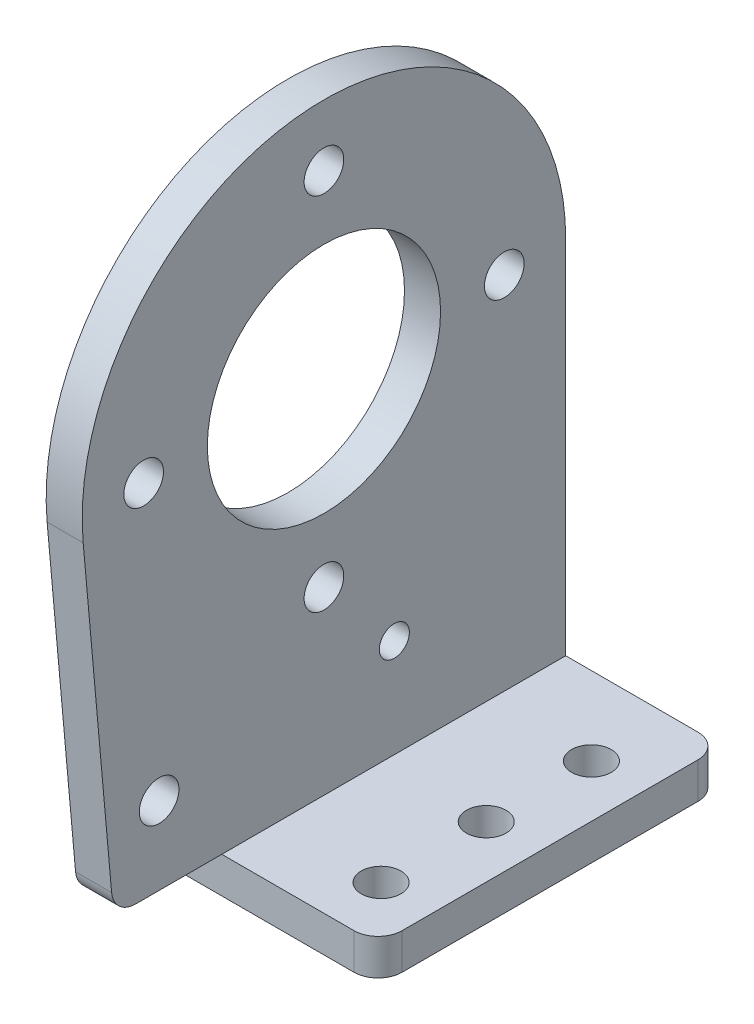
from build123d import *

# Parameters (mm, degrees)
SKETCH_2_W          = 28.61033589
SKETCH_2_H          = 3
EXTRUDE_5_DEPTH     = 16
SKETCH_3_R          = 1.65
CUT_EXTRUDE_1_DEPTH = 10
SKETCH_4_R          = 1.65
SKETCH_4_R_2        = 1.25
SKETCH_4_R_3        = 9.7
EXTRUDE_8_DEPTH     = 3
FILLET_1_R          = 2


with BuildPart() as part:
    # 草图2 → 凸台-拉伸5 (new body)
    with BuildSketch(Plane.ZY):
        with Locations((-23.305167945, 11.5)):
            Rectangle(SKETCH_2_W, SKETCH_2_H)
    extrude(amount=-EXTRUDE_5_DEPTH)

    # 草图3 → 切除-拉伸1 (cut)
    with BuildSketch(Plane(origin=(0, 13, 0), x_dir=(1, 0, 0), z_dir=(0, 1, 0))):
        with Locations(Location((11.65, 31.1, 0), (0, 0, 270))):
            Circle(SKETCH_3_R)
        with Locations(Location((11.65, 22.35, 0), (0, 0, 90))):
            Circle(SKETCH_3_R)
        with Locations(Location((11.65, 13.6, 0), (0, 0, 270))):
            Circle(SKETCH_3_R)
    extrude(amount=-CUT_EXTRUDE_1_DEPTH, mode=Mode.SUBTRACT)

    # 草图4 → 凸台-拉伸8 (add)
    with BuildSketch(Plane(origin=(0, 0, 0), x_dir=(0, 0, -1), z_dir=(1, 0, 0))):
        with BuildLine():
            Line((0, 13), (37.61033589, 13))
            Line((37.61033589, 13), (37.61033589, 42.99965258))
            ThreePointArc((37.61033589, 42.99965258), (16.600372012, 63.090063758), (-2.530280254, 41.20259366))
            Line((-2.530280254, 41.20259366), (0, 13))
        make_face()
        with Locations(Location((17.49980147, 57.99965258, 0), (0, 0, 180))):
            Circle(SKETCH_4_R, mode=Mode.SUBTRACT)
        with Locations(Location((32.49980147, 42.99965258, 0), (0, 0, 180))):
            Circle(SKETCH_4_R, mode=Mode.SUBTRACT)
        with Locations(Location((17.49980147, 27.99965258, 0), (0, 0, 180))):
            Circle(SKETCH_4_R, mode=Mode.SUBTRACT)
        with Locations(Location((2.49980147, 42.99965258, 0), (0, 0, 180))):
            Circle(SKETCH_4_R, mode=Mode.SUBTRACT)
        with Locations(Location((23.354935737, 21.197394906, 0), (0, 0, 180))):
            Circle(SKETCH_4_R_2, mode=Mode.SUBTRACT)
        with Locations(Location((3.788610616, 19.472011044, 0), (0, 0, 180))):
            Circle(SKETCH_4_R, mode=Mode.SUBTRACT)
        with Locations(Location((17.49980147, 42.99965258, 0), (0, 0, 180))):
            Circle(SKETCH_4_R_3, mode=Mode.SUBTRACT)
    extrude(amount=EXTRUDE_8_DEPTH)

    # 圆角1
    fillet_1_edges = [part.edges().sort_by_distance(p)[0] for p in [
        (16, 11.5, -37.61033589),
        (1.5, 13, 0),
        (16, 11.5, -9),
    ]]
    fillet(fillet_1_edges, radius=FILLET_1_R)


solid = part.part
